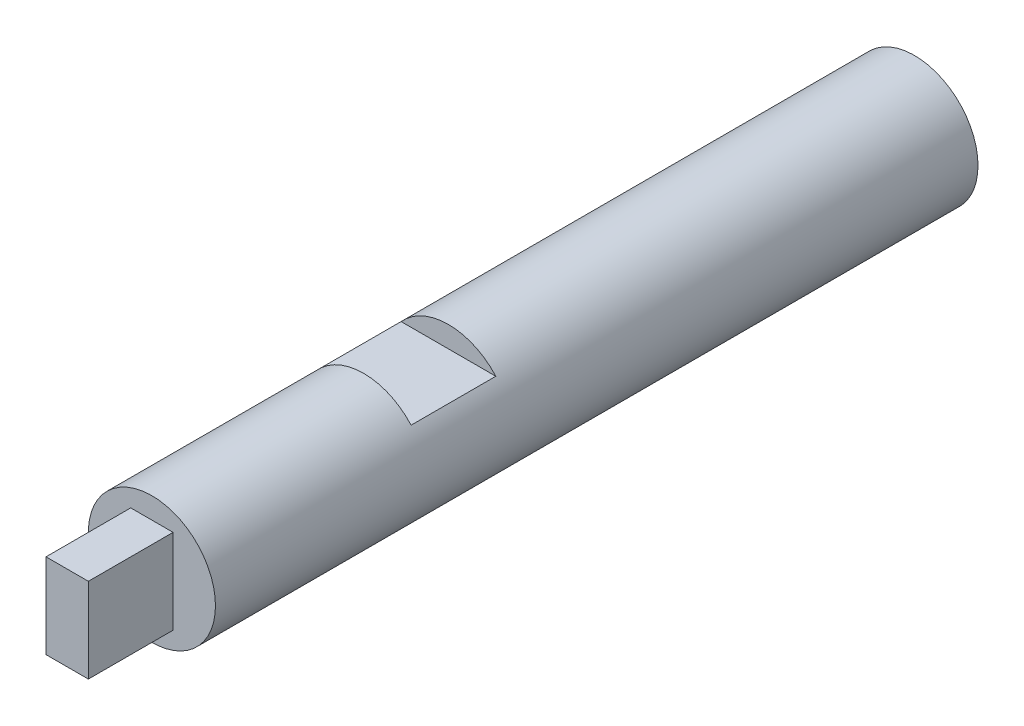
from build123d import *

# Parameters (mm, degrees)
SKETCH1_R           = 1.5
BOSS_EXTRUDE1_DEPTH = 18
SKETCH2_W           = 1
SKETCH2_H           = 2
BOSS_EXTRUDE2_DEPTH = 2
CUT_EXTRUDE1_START  = -5
SKETCH3_W           = 2.236067978
SKETCH3_H           = 1
CUT_EXTRUDE1_DEPTH  = 2


with BuildPart() as part:
    # Sketch1 → Boss-Extrude1 (new body)
    with BuildSketch(Plane.XY):
        with Locations((-50, 6)):
            Circle(SKETCH1_R)
    extrude(amount=BOSS_EXTRUDE1_DEPTH)

    # Sketch2 → Boss-Extrude2 (add)
    with BuildSketch(Plane.XY.offset(18)):
        with Locations((-50, 6)):
            Rectangle(SKETCH2_W, SKETCH2_H)
    extrude(amount=BOSS_EXTRUDE2_DEPTH)

    # Sketch3 → Cut-Extrude1 (cut)
    with BuildSketch(Plane.XY.offset(18).offset(CUT_EXTRUDE1_START)):
        with Locations((-50, 7.5)):
            Rectangle(SKETCH3_W, SKETCH3_H)
    extrude(amount=-CUT_EXTRUDE1_DEPTH, mode=Mode.SUBTRACT)


solid = part.part
